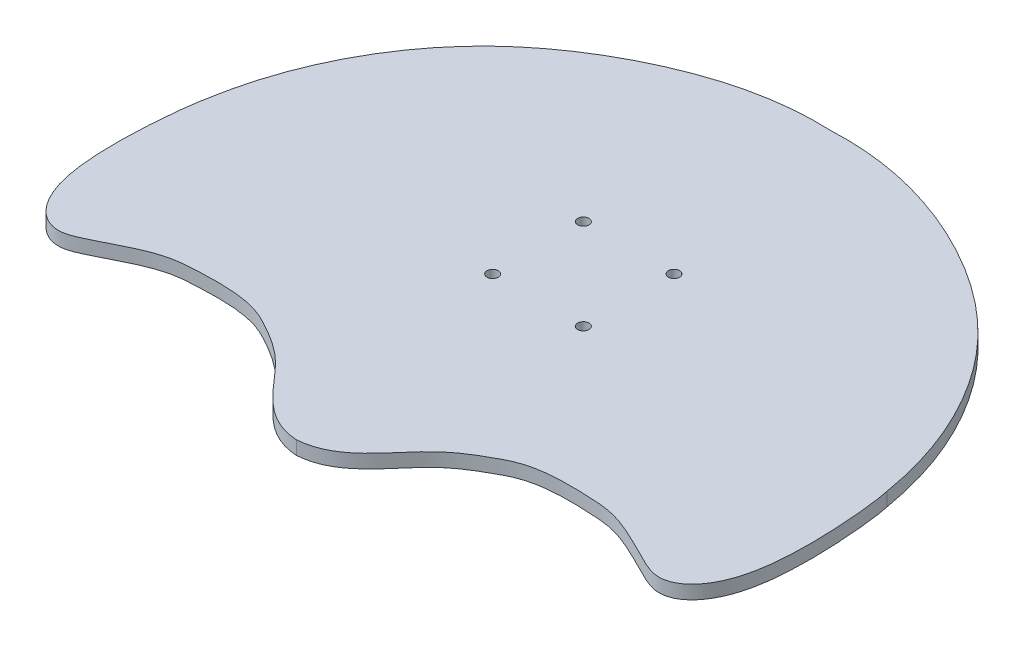
from build123d import *

# Parameters (mm, degrees)
BOSS_EXTRUDE1_DEPTH         = 7.62
F_1_4_0_25_DIAMETER_HOLE1_D = 6.35


with BuildPart() as part:
    # Sketch3 → Boss-Extrude1 (new body)
    with BuildSketch(Plane(origin=(0, 0, 0), x_dir=(1, 0, 0), z_dir=(0, 1, 0))):
        with BuildLine():
            add(Edge.make_bspline(
                [(-190.5, 0), (-184.392726562, 37.537038237), (-157.261289847, 93.964093485), (-82.387478202, 146.622658841), (-31.311374143, 160.799884185), (0, 159.189909928)],
                knots=[0, 0, 0, 0, 0.424401366, 0.656369581, 1, 1, 1, 1], degree=3))
            add(Edge.make_bspline(
                [(190.5, 0), (184.392726562, 37.537038237), (157.261289847, 93.964093485), (82.387478202, 146.622658841), (31.311374143, 160.799884185), (0, 159.189909928)],
                knots=[0, 0, 0, 0, 0.424401366, 0.656369581, 1, 1, 1, 1], degree=3))
            add(Edge.make_bspline(
                [(190.5, 0), (192.064011793, -4.963501926), (201.967167766, -83.314618311), (174.696602041, -109.289958804), (151.630121659, -100.567984898), (131.410771519, -87.719783961), (96.843567628, -85.375403377), (78.692510144, -86.25882742), (58.833533072, -96.87938247), (37.30593461, -109.935798162), (21.349613946, -139.114767457), (0, -140.530090072)],
                knots=[0, 0, 0, 0, 0.166997052, 0.292320514, 0.319633117, 0.42673531, 0.45891405, 0.609241775, 0.641909704, 0.76680237, 1, 1, 1, 1], degree=3))
            add(Edge.make_bspline(
                [(-190.5, 0), (-192.064011793, -4.963501926), (-201.967167766, -83.314618311), (-174.696602041, -109.289958804), (-151.630121659, -100.567984898), (-131.410771519, -87.719783961), (-96.843567628, -85.375403377), (-78.692510144, -86.25882742), (-58.833533072, -96.87938247), (-37.30593461, -109.935798162), (-21.349613946, -139.114767457), (0, -140.530090072)],
                knots=[0, 0, 0, 0, 0.166997052, 0.292320514, 0.319633117, 0.42673531, 0.45891405, 0.609241775, 0.641909704, 0.76680237, 1, 1, 1, 1], degree=3))
        make_face()
    extrude(amount=BOSS_EXTRUDE1_DEPTH)

    # 1/4 (0.25) Diameter Hole1 (through all)
    with Locations(Plane(origin=(0, 0, 0), x_dir=(-1, 0, 0), z_dir=(0, -1, 0))):
        with Locations((-25.4, 45.72), (25.4, 45.72), (25.4, -5.08), (-25.4, -5.08)):
            Hole(F_1_4_0_25_DIAMETER_HOLE1_D / 2)


solid = part.part
